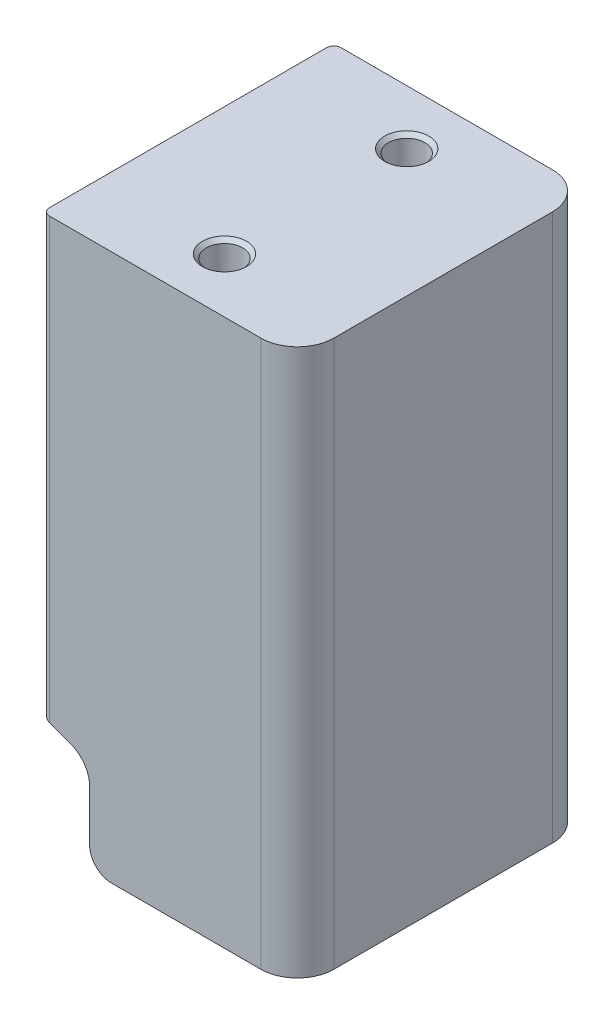
from build123d import *

# Parameters (mm, degrees)
SKETCH1_W                   = 35
SKETCH1_H                   = 40
BOSS_EXTRUDE1_DEPTH         = 75
CUT_EXTRUDE1_REACH          = 88.783
FILLET1_R                   = 3
FILLET2_R                   = 5
M6_TAPPED_HOLE1_D           = 5
M6_TAPPED_HOLE1_DEPTH       = 17
M6_TAPPED_HOLE1_CSINK_D     = 6.05
M6_TAPPED_HOLE1_CSINK_ANGLE = 90
M6_TAPPED_HOLE1_TIP         = 1.502151548
FILLET3_R                   = 1


with BuildPart() as part:
    # Sketch1 → Boss-Extrude1 (new body)
    with BuildSketch(Plane(origin=(0, 0, 0), x_dir=(1, 0, 0), z_dir=(0, 1, 0))):
        Rectangle(SKETCH1_W, SKETCH1_H)
    extrude(amount=-BOSS_EXTRUDE1_DEPTH)

    # Sketch2 → Cut-Extrude1 (cut, up to next)
    with BuildSketch(Plane.XY.offset(20), mode=Mode.PRIVATE) as cut_extrude1_sk1:
        with BuildLine():
            Line((-13.631919427, -61.241229517), (-17.5, -59.833363324))
            Line((-17.5, -59.833363324), (-17.5, -75))
            Line((-17.5, -75), (-11, -75))
            Line((-11, -75), (-11, -65))
            ThreePointArc((-11, -65), (-11.723391823, -62.705694255), (-13.631919427, -61.241229517))
        make_face()
    cut_extrude1_tool1 = extrude(cut_extrude1_sk1.sketch, amount=-CUT_EXTRUDE1_REACH, mode=Mode.PRIVATE) & part.part
    add(cut_extrude1_tool1.solids().sort_by_distance((-14.386052, -68.077717, 20))[0], mode=Mode.SUBTRACT)

    # Fillet1
    fillet1_edges = [part.edges().sort_by_distance(p)[0] for p in [
        (-11, -75, 0),
    ]]
    fillet(fillet1_edges, radius=FILLET1_R)

    # Fillet2
    fillet2_edges = [part.edges().sort_by_distance(p)[0] for p in [
        (17.5, -37.5, 20),
        (17.5, -37.5, -20),
    ]]
    fillet(fillet2_edges, radius=FILLET2_R)

    # M6 Tapped Hole1
    with Locations(Plane(origin=(0, 0, 0), x_dir=(1, 0, 0), z_dir=(0, 1, 0))):
        with Locations((0, 12.5), (0, -12.5)):
            CounterSinkHole(M6_TAPPED_HOLE1_D / 2, M6_TAPPED_HOLE1_CSINK_D / 2, depth=M6_TAPPED_HOLE1_DEPTH, counter_sink_angle=M6_TAPPED_HOLE1_CSINK_ANGLE)
            with Locations((0, 0, -(M6_TAPPED_HOLE1_DEPTH + M6_TAPPED_HOLE1_TIP / 2))):  # 118° drill point
                Cone(0, M6_TAPPED_HOLE1_D / 2, M6_TAPPED_HOLE1_TIP, mode=Mode.SUBTRACT)

    # Fillet3
    fillet3_edges = [part.edges().sort_by_distance(p)[0] for p in [
        (-17.5, -29.916681662, -20),
        (-17.5, -29.916681662, 20),
    ]]
    fillet(fillet3_edges, radius=FILLET3_R)


solid = part.part
